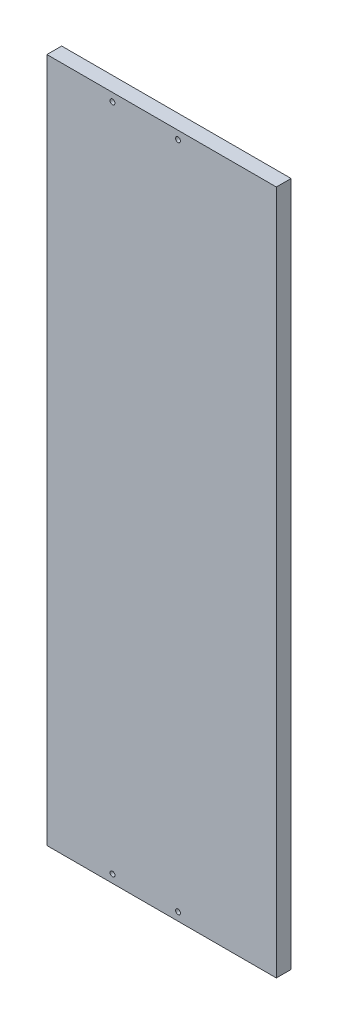
from build123d import *

# Parameters (mm, degrees)
SKETCH_1_W      = 140
SKETCH_1_H      = 418
SKETCH_1_R      = 1.5
EXTRUDE_1_DEPTH = 9


with BuildPart() as part:
    # Эскиз1 → Бобышка-Вытянуть1 (new body)
    with BuildSketch(Plane.XY.offset(9)):
        with Locations((70, 209)):
            Rectangle(SKETCH_1_W, SKETCH_1_H)
        with Locations(Location((80, 413, 0), (0, 0, 180))):
            Circle(SKETCH_1_R, mode=Mode.SUBTRACT)
        with Locations(Location((40, 413, 0), (0, 0, 180))):
            Circle(SKETCH_1_R, mode=Mode.SUBTRACT)
        with Locations(Location((40, 5, 0), (0, 0, 180))):
            Circle(SKETCH_1_R, mode=Mode.SUBTRACT)
        with Locations(Location((80, 5, 0), (0, 0, 180))):
            Circle(SKETCH_1_R, mode=Mode.SUBTRACT)
    extrude(amount=-EXTRUDE_1_DEPTH)


solid = part.part
